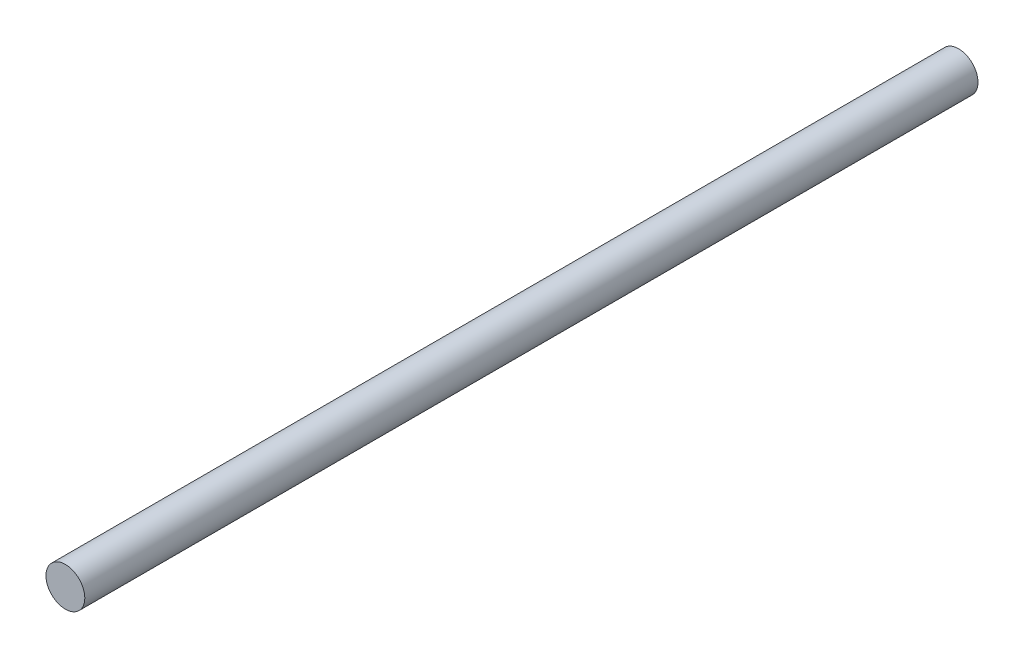
from build123d import *

# Parameters (mm, degrees)
SZKIC1_R                    = 5
DODANIE_WYCI_GNI_CIE1_DEPTH = 230


with BuildPart() as part:
    # Szkic1 → Dodanie-wyciągnięcie1 (new body)
    with BuildSketch(Plane.XY):
        Circle(SZKIC1_R)
    extrude(amount=DODANIE_WYCI_GNI_CIE1_DEPTH)


solid = part.part
